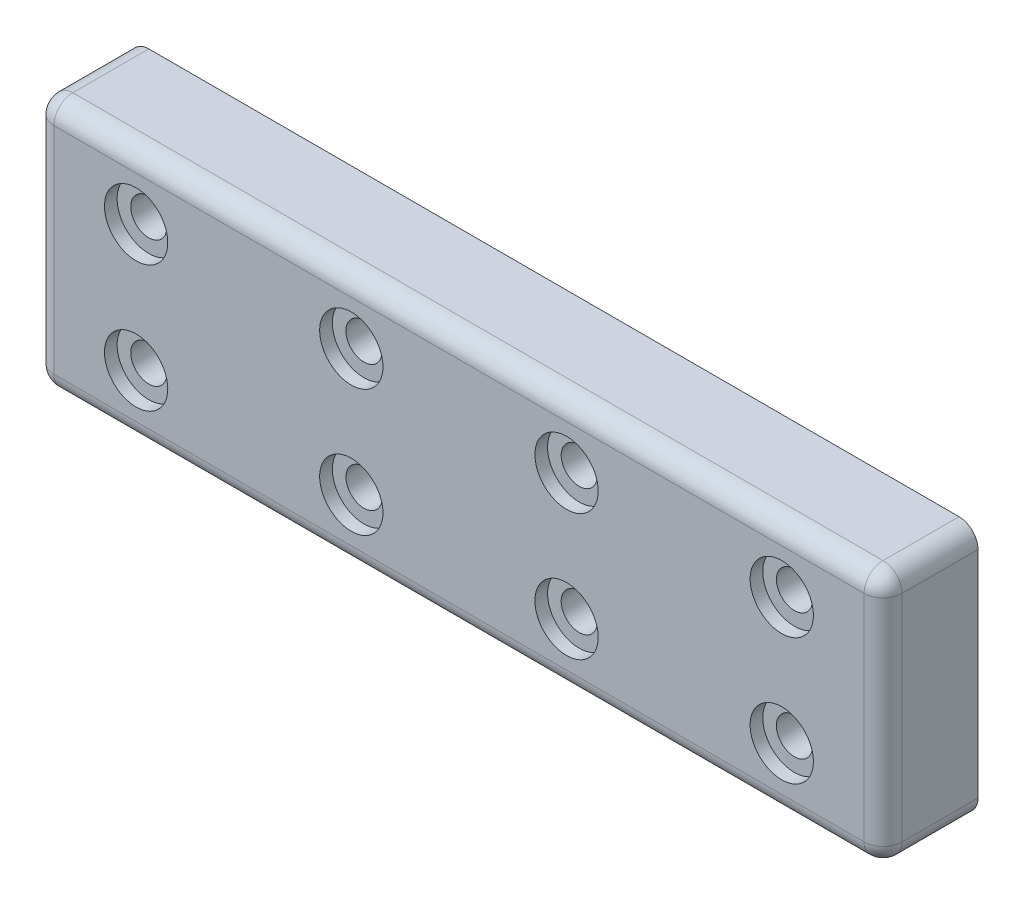
from build123d import *

# Parameters (mm, degrees)
SKETCH1_W           = 134
SKETCH1_H           = 40
SKETCH1_R           = 2.85
BOSS_EXTRUDE1_DEPTH = 15
SKETCH2_R           = 5
CUT_EXTRUDE1_DEPTH  = 2
FILLET1_R           = 3


with BuildPart() as part:
    # Sketch1 → Boss-Extrude1 (new body)
    with BuildSketch(Plane.XY):
        Rectangle(SKETCH1_W, SKETCH1_H)
        with Locations((-51, 10)):
            Circle(SKETCH1_R, mode=Mode.SUBTRACT)
        with Locations((-17, 10)):
            Circle(SKETCH1_R, mode=Mode.SUBTRACT)
        with Locations((17, 10)):
            Circle(SKETCH1_R, mode=Mode.SUBTRACT)
        with Locations((51, 10)):
            Circle(SKETCH1_R, mode=Mode.SUBTRACT)
        with Locations((-17, -10)):
            Circle(SKETCH1_R, mode=Mode.SUBTRACT)
        with Locations((17, -10)):
            Circle(SKETCH1_R, mode=Mode.SUBTRACT)
        with Locations((51, -10)):
            Circle(SKETCH1_R, mode=Mode.SUBTRACT)
        with Locations((-51, -10)):
            Circle(SKETCH1_R, mode=Mode.SUBTRACT)
    extrude(amount=BOSS_EXTRUDE1_DEPTH)

    # Sketch2 → Cut-Extrude1 (cut)
    with BuildSketch(Plane.XY.offset(15)):
        with Locations((-51, 10)):
            Circle(SKETCH2_R)
        with Locations((-17, 10)):
            Circle(SKETCH2_R)
        with Locations((17, 10)):
            Circle(SKETCH2_R)
        with Locations((51, 10)):
            Circle(SKETCH2_R)
        with Locations((-17, -10)):
            Circle(SKETCH2_R)
        with Locations((17, -10)):
            Circle(SKETCH2_R)
        with Locations((51, -10)):
            Circle(SKETCH2_R)
        with Locations((-51, -10)):
            Circle(SKETCH2_R)
    extrude(amount=-CUT_EXTRUDE1_DEPTH, mode=Mode.SUBTRACT)

    # Fillet1
    fillet1_edges = [part.edges().sort_by_distance(p)[0] for p in [
        (-67, 0, 15),
        (0, -20, 15),
        (67, 0, 15),
        (67, -20, 7.5),
        (-67, -20, 7.5),
        (-67, 20, 7.5),
        (67, 20, 7.5),
        (0, 20, 15),
    ]]
    fillet(fillet1_edges, radius=FILLET1_R)


solid = part.part
